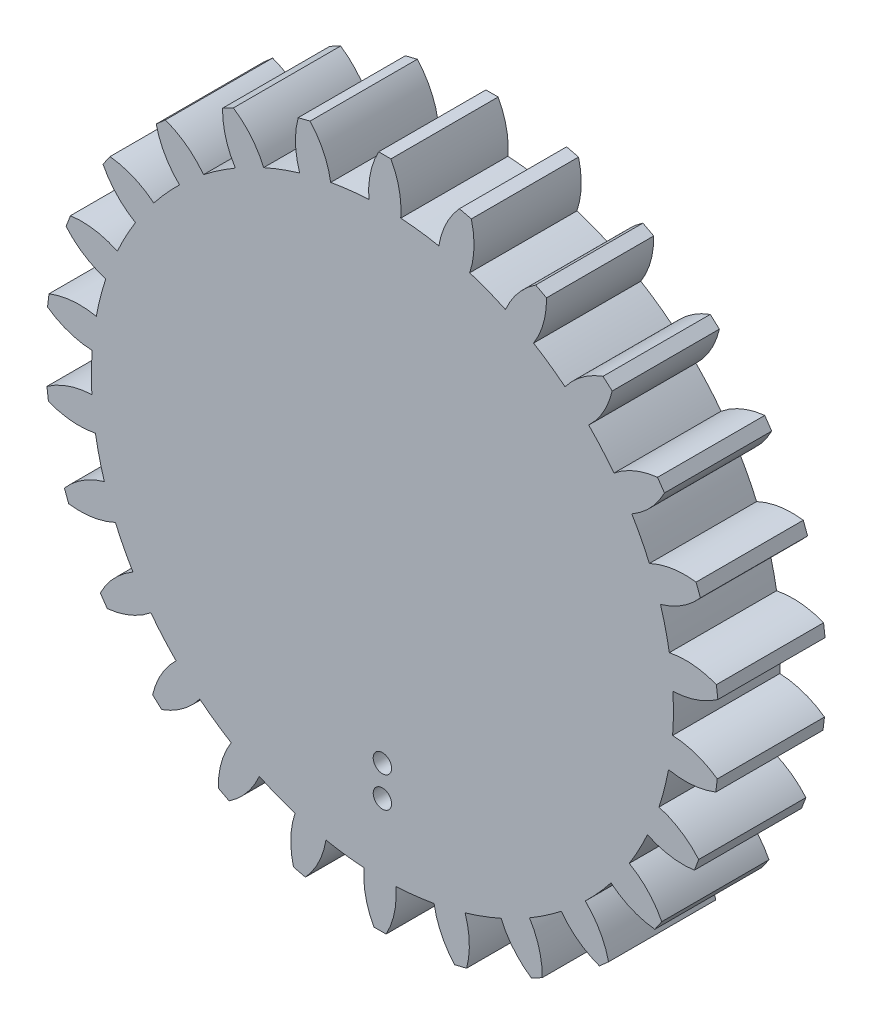
from build123d import *

# Parameters (mm, degrees)
SKETCH1_R           = 19
BOSS_EXTRUDE2_DEPTH = 7
BOSS_EXTRUDE3_DEPTH = 7
CIRPATTERN1_COUNT   = 26
SKETCH1_7_R         = 0.6
CUT_EXTRUDE1_DEPTH  = 4
SKETCH1_8_R         = 0.6
CUT_EXTRUDE2_DEPTH  = 7


with BuildPart() as part:
    # Sketch1 → Boss-Extrude2 (new body)
    with BuildSketch(Plane.XY):
        Circle(SKETCH1_R)
    extrude(amount=BOSS_EXTRUDE2_DEPTH)

    # Sketch1<6> → Boss-Extrude3 (add)
    with BuildSketch(Plane.XY):
        with BuildLine():
            Line((-0.557497486, -21.995033976), (0.242502514, -21.995033976))
            ThreePointArc((0.242502514, -21.995033976), (0.782724682, -20.5339516), (0.883393299, -18.979452476))
            ThreePointArc((0.883393299, -18.979452476), (-0.157029313, -18.999351089), (-1.196980891, -18.962258219))
            ThreePointArc((-1.196980891, -18.962258219), (-1.099506092, -20.525512733), (-0.557497486, -21.995033976))
        make_face()
    boss_extrude3 = extrude(amount=BOSS_EXTRUDE3_DEPTH)

    # CirPattern1: Boss-Extrude3 ×26 about axis
    cirpattern1_axis = Axis((0, 0, 0), (0, 0, 1))
    for i in range(1, CIRPATTERN1_COUNT):
        add(boss_extrude3.rotate(cirpattern1_axis, i * 360 / CIRPATTERN1_COUNT))

    # Sketch1<7> → Cut-Extrude1 (cut)
    with BuildSketch(Plane.XY):
        with BuildLine():
            Line((-2.025, -14.025), (-2.65, -2.286372673))
            ThreePointArc((-2.65, -2.286372673), (0, 3.5), (2.65, -2.286372673))
            Line((2.65, -2.286372673), (2.025, -14.025))
            ThreePointArc((2.025, -14.025), (0, -16.05), (-2.025, -14.025))
        make_face()
        with Locations((0, -14.45)):
            Circle(SKETCH1_7_R, mode=Mode.SUBTRACT)
        with Locations((0, -12.45)):
            Circle(SKETCH1_7_R, mode=Mode.SUBTRACT)
    extrude(amount=CUT_EXTRUDE1_DEPTH, mode=Mode.SUBTRACT)

    # Sketch1<8> → Cut-Extrude2 (cut)
    with BuildSketch(Plane.XY):
        with Locations((0, -14.45)):
            Circle(SKETCH1_8_R)
        with Locations((0, -12.45)):
            Circle(SKETCH1_8_R)
    extrude(amount=CUT_EXTRUDE2_DEPTH, mode=Mode.SUBTRACT)


solid = part.part
